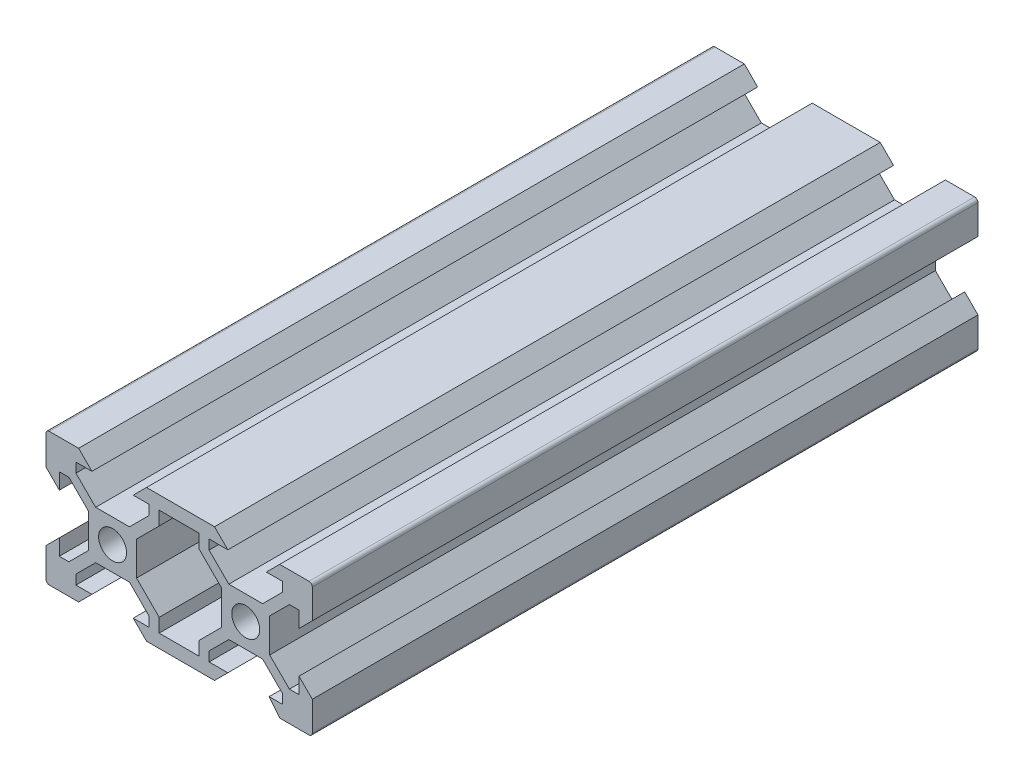
from build123d import *

# Parameters (mm, degrees)
SKETCH1_R           = 2.1
BOSS_EXTRUDE1_DEPTH = 100
FILLET1_R           = 0.5


with BuildPart() as part:
    # Sketch1 → Boss-Extrude1 (new body)
    with BuildSketch(Plane.XY):
        Polygon((-20, -10), (-15.5, -10), (-15.1, -10), (-13.1, -8), (-15.5, -8), (-15.5, -6.560660172), (-12.539339828, -3.6), (-7.460660172, -3.6), (-4.5, -6.560660172), (-4.5, -8), (-6.9, -8), (-4.9, -10), (5.313777138, -10), (7.313777138, -8), (4.5, -8), (4.5, -6.560660172), (7.460660172, -3.6), (12.539339828, -3.6), (15.5, -6.560660172), (15.5, -8), (13.513777138, -8), (15.1, -10), (15.5, -10), (20, -10), (20, -5.5), (20, -5.1), (18, -3.1), (18, -5.5), (16.560660172, -5.5), (13.6, -2.539339828), (13.6, 2.539339828), (16.560660172, 5.5), (18, 5.5), (18, 3.1), (20, 5.1), (20, 5.5), (20, 10), (15.5, 10), (15.1, 10), (13.1, 8), (15.5, 8), (15.5, 6.560660172), (12.539339828, 3.6), (7.460660172, 3.6), (4.5, 6.560660172), (4.5, 8), (7.313777138, 8), (5.313777138, 10), (-4.9, 10), (-6.9, 8), (-4.5, 8), (-4.5, 6.560660172), (-7.460660172, 3.6), (-12.539339828, 3.6), (-15.5, 6.560660172), (-15.5, 8), (-13.1, 8), (-15.1, 10), (-15.5, 10), (-20, 10), (-20, 5.5), (-20, 5.1), (-18, 3.1), (-18, 5.5), (-16.560660172, 5.5), (-13.6, 2.539339828), (-13.6, -2.539339828), (-16.560660172, -5.5), (-18, -5.5), (-18, -3.1), (-20, -5.1), (-20, -5.5), align=None)
        with Locations((-10, 0)):
            Circle(SKETCH1_R, mode=Mode.SUBTRACT)
        with Locations((10, 0)):
            Circle(SKETCH1_R, mode=Mode.SUBTRACT)
        Polygon((3, -5.939339828), (3, -8), (-3, -8), (-3, -5.939339828), (-6.4, -2.539339828), (-6.4, 2.539339828), (-3, 5.939339828), (-3, 8), (3, 8), (3, 5.939339828), (6.4, 2.539339828), (6.4, -2.539339828), align=None, mode=Mode.SUBTRACT)
    extrude(amount=BOSS_EXTRUDE1_DEPTH)

    # Fillet1
    fillet1_edges = [part.edges().sort_by_distance(p)[0] for p in [
        (-20, 10, 50),
        (20, 10, 50),
        (20, -10, 50),
        (-20, -10, 50),
    ]]
    fillet(fillet1_edges, radius=FILLET1_R)


solid = part.part
